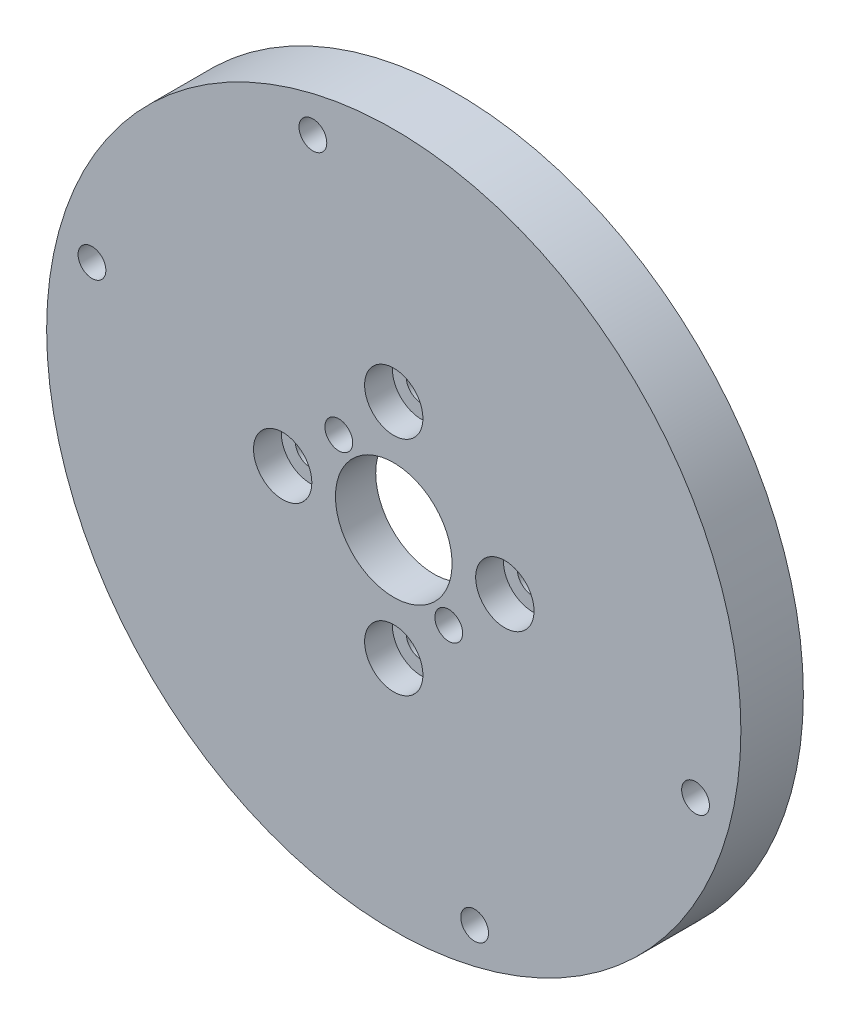
from build123d import *

# Parameters (mm, degrees)
SKETCH_1_R          = 25
SKETCH_1_R_2        = 2.3
SKETCH_1_R_3        = 1.1
SKETCH_1_R_4        = 1
EXTRUDE_1_DEPTH     = 4.5
SKETCH_2_R          = 2.1
CUT_EXTRUDE_1_DEPTH = 2
SKETCH_10_R         = 10
CUT_EXTRUDE_7_DEPTH = 1.6
SKETCH_9_R          = 4.2
CUT_EXTRUDE_5_DEPTH = 36.474075041
SKETCH_6_R          = 1
CUT_EXTRUDE_6_DEPTH = 2


with BuildPart() as part:
    # 스케치1 → 보스-돌출1 (new body)
    with BuildSketch(Plane.XY):
        Circle(SKETCH_1_R)
        Circle(SKETCH_1_R_2, mode=Mode.SUBTRACT)
        with Locations((0, 8)):
            Circle(SKETCH_1_R_3, mode=Mode.SUBTRACT)
        with Locations((8, 0)):
            Circle(SKETCH_1_R_3, mode=Mode.SUBTRACT)
        with Locations((0, -8)):
            Circle(SKETCH_1_R_3, mode=Mode.SUBTRACT)
        with Locations((-8, 0)):
            Circle(SKETCH_1_R_3, mode=Mode.SUBTRACT)
        with Locations((-5.823428515, 21.733331092)):
            Circle(SKETCH_1_R_4, mode=Mode.SUBTRACT)
        with Locations(Location((21.733331092, -5.823428515, 0), (0, 0, 180))):
            Circle(SKETCH_1_R_4, mode=Mode.SUBTRACT)
        with Locations((5.823428515, -21.733331092)):
            Circle(SKETCH_1_R_4, mode=Mode.SUBTRACT)
        with Locations(Location((-21.733331092, 5.823428515, 0), (0, 0, 180))):
            Circle(SKETCH_1_R_4, mode=Mode.SUBTRACT)
    extrude(amount=EXTRUDE_1_DEPTH)

    # 스케치2 → 컷-돌출1 (cut)
    with BuildSketch(Plane.XY.offset(4.5)):
        with Locations((0, 8)):
            Circle(SKETCH_2_R)
        with Locations((8, 0)):
            Circle(SKETCH_2_R)
        with Locations((0, -8)):
            Circle(SKETCH_2_R)
        with Locations((-8, 0)):
            Circle(SKETCH_2_R)
    extrude(amount=-CUT_EXTRUDE_1_DEPTH, mode=Mode.SUBTRACT)

    # 스케치10 → 컷-돌출7 (cut)
    with BuildSketch(Plane(origin=(0, 0, 0), x_dir=(-1, 0, 0), z_dir=(0, 0, -1))):
        Circle(SKETCH_10_R)
    extrude(amount=-CUT_EXTRUDE_7_DEPTH, mode=Mode.SUBTRACT)

    # 스케치9 → 컷-돌출5 (cut, through all)
    with BuildSketch(Plane(origin=(0, 0, 1.6), x_dir=(-1, 0, 0), z_dir=(0, 0, -1))):
        Circle(SKETCH_9_R)
    extrude(amount=-CUT_EXTRUDE_5_DEPTH, mode=Mode.SUBTRACT)

    # 스케치6 → 컷-돌출6 (cut)
    with BuildSketch(Plane.XY.offset(4.5)):
        with Locations((-3.959797975, 3.959797975)):
            Circle(SKETCH_6_R)
        with Locations((3.959797975, -3.959797975)):
            Circle(SKETCH_6_R)
    extrude(amount=-CUT_EXTRUDE_6_DEPTH, mode=Mode.SUBTRACT)


solid = part.part
